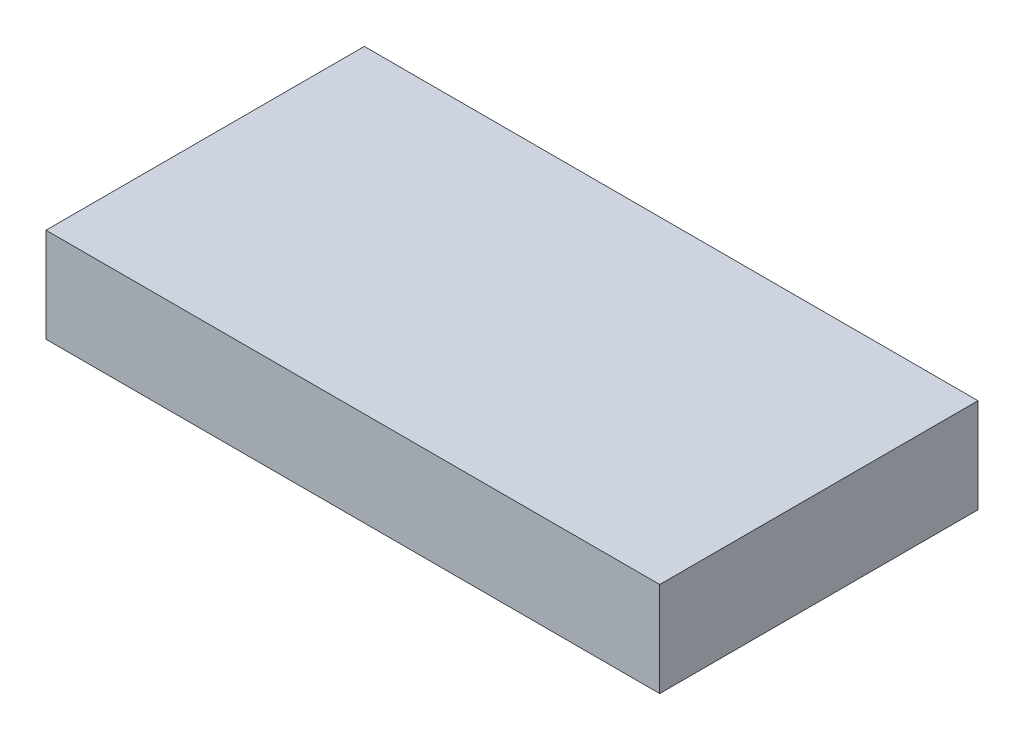
from build123d import *

# Parameters (mm, degrees)
SKETCH1_W           = 64.951726253
SKETCH1_H           = 33.689041921
BOSS_EXTRUDE1_DEPTH = 10


with BuildPart() as part:
    # Sketch1 → Boss-Extrude1 (new body)
    with BuildSketch(Plane(origin=(0, 0, 0), x_dir=(1, 0, 0), z_dir=(0, 1, 0))):
        with Locations((32.475863127, 16.844520961)):
            Rectangle(SKETCH1_W, SKETCH1_H)
    extrude(amount=BOSS_EXTRUDE1_DEPTH)


solid = part.part
